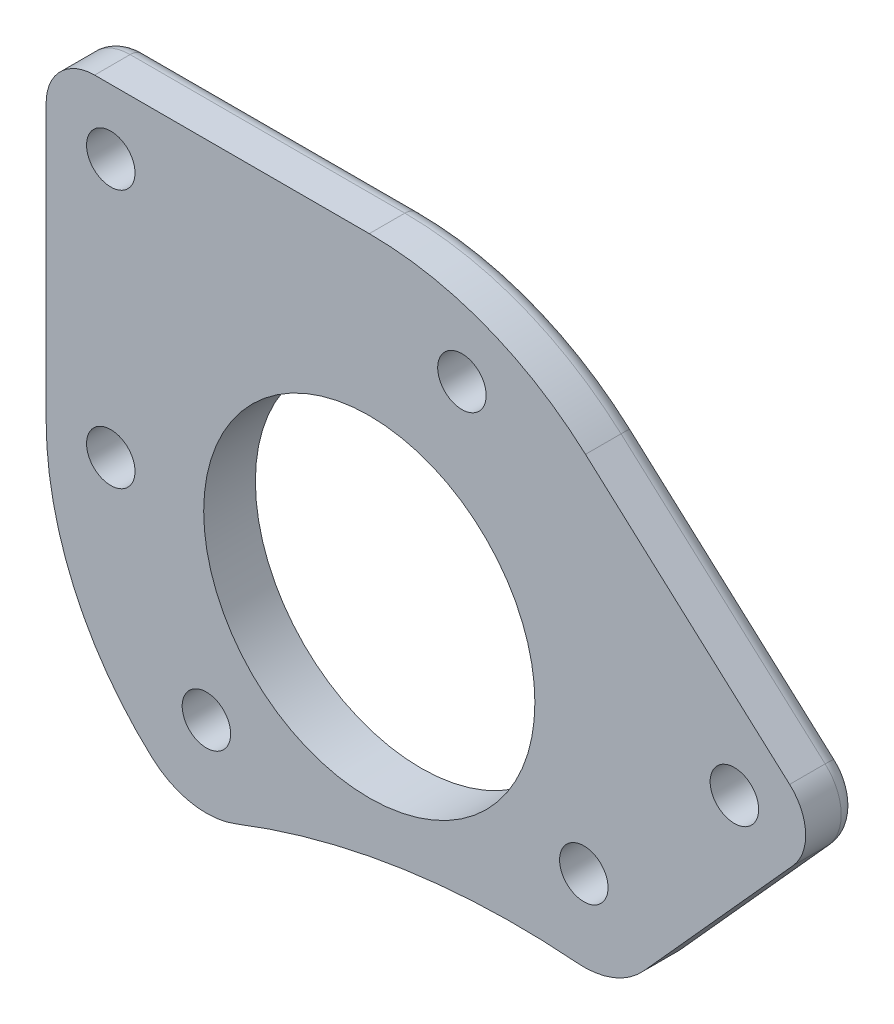
from build123d import *

# Parameters (mm, degrees)
SKETCH_1_R      = 10.25
SKETCH_1_R_2    = 1.5
EXTRUDE_1_DEPTH = 3.2
FILLET_1_R      = 1


with BuildPart() as part:
    # 草图1 → 凸台-拉伸1 (new body)
    with BuildSketch(Plane.XY):
        with BuildLine():
            Line((4.334015044, 74.86289651), (16.967477077, 63.487676201))
            ThreePointArc((16.967477077, 63.487676201), (17.955973862, 61.415249594), (17.189519734, 59.250849906))
            Line((17.189519734, 59.250849906), (7.944957082, 48.983722931))
            ThreePointArc((7.944957082, 48.983722931), (6.077132686, 47.683381281), (3.826448864, 47.345625871))
            ThreePointArc((3.826448864, 47.345625871), (-6.917114554, 46.993654106), (-17.306435746, 44.235023248))
            ThreePointArc((-17.306435746, 44.235023248), (-20.032995202, 43.973894607), (-22.488022071, 45.188455313))
            ThreePointArc((-22.488022071, 45.188455313), (-27.335046982, 51.900262342), (-29.048597084, 60))
            Line((-29.048597084, 60), (-29.048597084, 77))
            ThreePointArc((-29.048597084, 77), (-28.169917427, 79.121320344), (-26.048597084, 80))
            Line((-26.048597084, 80), (-9.048597084, 80))
            ThreePointArc((-9.048597084, 80), (-1.881238093, 78.67160853), (4.334015044, 74.86289651))
        make_face()
        with Locations((-9.048597084, 60)):
            Circle(SKETCH_1_R, mode=Mode.SUBTRACT)
        with Locations((-25.048597084, 76)):
            Circle(SKETCH_1_R_2, mode=Mode.SUBTRACT)
        with Locations((-3.314709891, 74.937286824)):
            Circle(SKETCH_1_R_2, mode=Mode.SUBTRACT)
        with Locations((-25.048597084, 60)):
            Circle(SKETCH_1_R_2, mode=Mode.SUBTRACT)
        with Locations((-19.128165824, 48.891341485)):
            Circle(SKETCH_1_R_2, mode=Mode.SUBTRACT)
        with Locations((4.229232955, 52.329375962)):
            Circle(SKETCH_1_R_2, mode=Mode.SUBTRACT)
        with Locations((13.547809826, 61.184227506)):
            Circle(SKETCH_1_R_2, mode=Mode.SUBTRACT)
    extrude(amount=EXTRUDE_1_DEPTH)

    # 圆角1
    fillet_1_edges = [part.edges().sort_by_distance(p)[0] for p in [
        (-29.048597084, 68.5, 0),
        (-28.169917427, 79.121320344, 0),
        (-17.548597084, 80, 0),
        (-1.881238093, 78.67160853, 0),
        (10.65074606, 69.175286355, 0),
        (17.955973862, 61.415249594, 0),
        (12.567238408, 54.117286418, 0),
        (6.077132686, 47.683381281, 0),
        (-6.917114554, 46.993654106, 0),
        (-20.032995202, 43.973894607, 0),
        (-27.335046982, 51.900262342, 0),
    ]]
    fillet(fillet_1_edges, radius=FILLET_1_R)


solid = part.part
